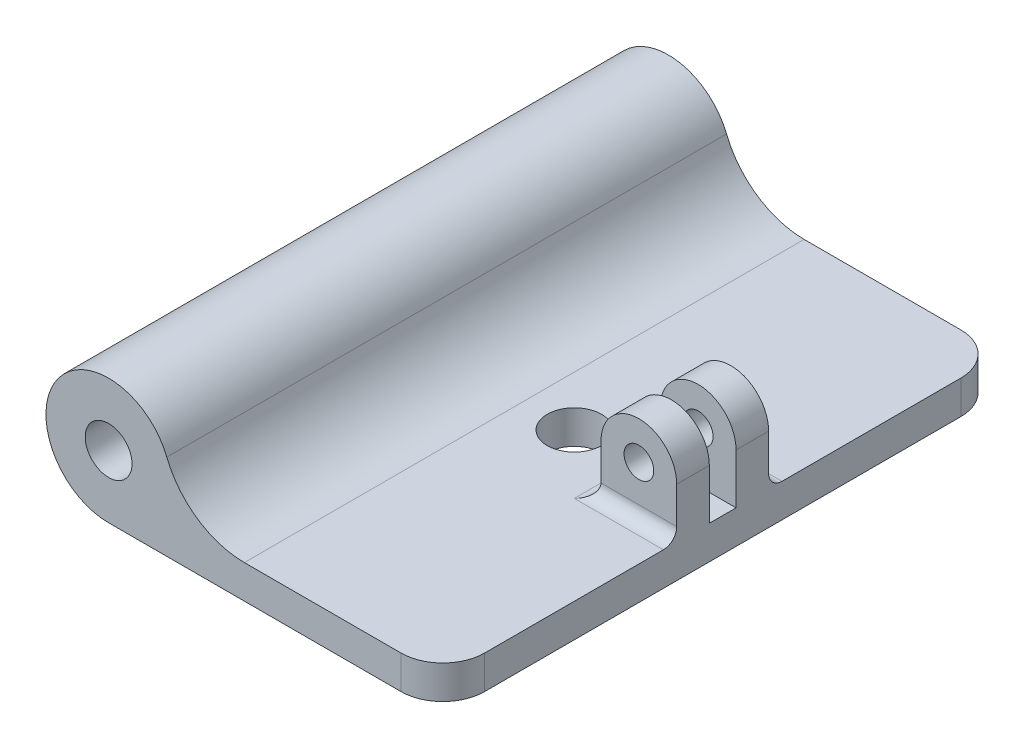
from build123d import *

# Parameters (mm, degrees)
SKETCH1_R           = 2.8
BOSS_EXTRUDE1_DEPTH = 67
SKETCH2_R           = 3.25
CUT_EXTRUDE1_DEPTH  = 100
SKETCH3_R           = 1.778
BOSS_EXTRUDE2_DEPTH = 5.5
SKETCH3_3_R         = 1.778
CUT_EXTRUDE2_DEPTH  = 1.6
FILLET1_R           = 1.6
FILLET2_R           = 5


with BuildPart() as part:
    # Sketch1 → Boss-Extrude1 (new body)
    with BuildSketch(Plane.XY):
        with BuildLine():
            Line((16.248076809, -3.5), (40, -3.5))
            Line((40, -3.5), (40, -7.5))
            Line((40, -7.5), (0, -7.5))
            ThreePointArc((0, -7.5), (-6.210590034, 4.204589329), (6.96346149, 2.785714286))
            ThreePointArc((6.96346149, 2.785714286), (10.641957703, -1.780786712), (16.248076809, -3.5))
        make_face()
        Circle(SKETCH1_R, mode=Mode.SUBTRACT)
    extrude(amount=BOSS_EXTRUDE1_DEPTH)

    # Sketch2 → Cut-Extrude1 (cut)
    with BuildSketch(Plane(origin=(0, -3.5, 0), x_dir=(1, 0, 0), z_dir=(0, 1, 0))):
        with Locations((22.248076809, -33.5)):
            Circle(SKETCH2_R)
    extrude(amount=-CUT_EXTRUDE1_DEPTH, mode=Mode.SUBTRACT)

    # Sketch3 → Boss-Extrude2 (add, symmetric)
    with BuildSketch(Plane.XY.offset(33.5)):
        with BuildLine():
            Line((30.94, -3.5), (40, -3.5))
            Line((40, -3.5), (40, 2.5))
            ThreePointArc((40, 2.5), (35.47, 7.03), (30.94, 2.5))
            Line((30.94, 2.5), (30.94, -3.5))
        make_face()
        with Locations((35.47, 2.5)):
            Circle(SKETCH3_R, mode=Mode.SUBTRACT)
    extrude(amount=BOSS_EXTRUDE2_DEPTH, both=True)

    # Sketch3<3> → Cut-Extrude2 (cut, symmetric)
    with BuildSketch(Plane.XY.offset(33.5)):
        with BuildLine():
            Line((30.94, -3.5), (40, -3.5))
            Line((40, -3.5), (40, 2.5))
            ThreePointArc((40, 2.5), (35.47, 7.03), (30.94, 2.5))
            Line((30.94, 2.5), (30.94, -3.5))
        make_face()
        with Locations((35.47, 2.5)):
            Circle(SKETCH3_3_R, mode=Mode.SUBTRACT)
    extrude(amount=CUT_EXTRUDE2_DEPTH, both=True, mode=Mode.SUBTRACT)

    # Fillet1
    fillet1_edges = [part.edges().sort_by_distance(p)[0] for p in [
        (35.47, -3.5, 28),
        (30.94, -3.5, 29.95),
        (30.94, -3.5, 37.05),
        (35.47, -3.5, 39),
    ]]
    fillet(fillet1_edges, radius=FILLET1_R)

    # Fillet2
    fillet2_edges = [part.edges().sort_by_distance(p)[0] for p in [
        (40, -5.5, 0),
        (40, -5.5, 67),
    ]]
    fillet(fillet2_edges, radius=FILLET2_R)


solid = part.part
